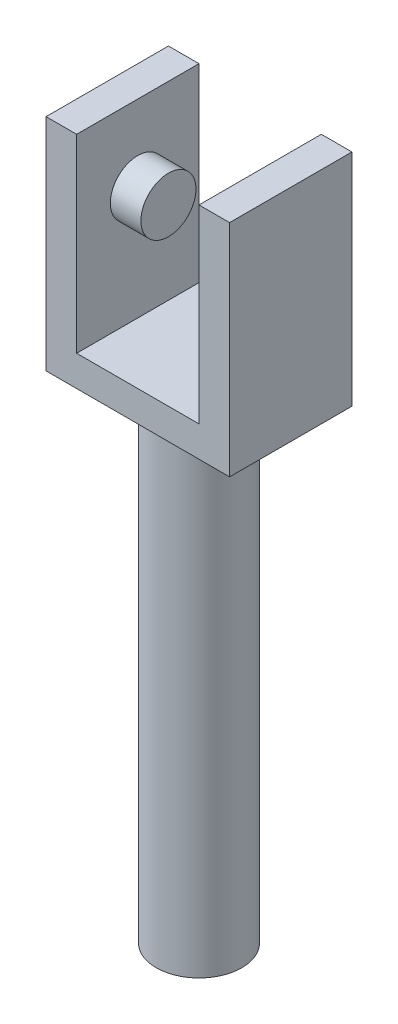
from build123d import *

# Parameters (mm, degrees)
SKETCH1_R           = 35
BOSS_EXTRUDE1_DEPTH = 392.5
SKETCH2_W           = 150
SKETCH2_H           = 100
BOSS_EXTRUDE2_DEPTH = 180
SKETCH3_W           = 100
SKETCH3_H           = 125
CUT_EXTRUDE1_DEPTH  = 150
SKETCH4_R           = 22.5
BOSS_EXTRUDE3_DEPTH = 25
BOSS_EXTRUDE4_START = 25
SKETCH5_R           = 22.5
BOSS_EXTRUDE4_DEPTH = 25
SKETCH6_W           = 100
SKETCH6_H           = 30
CUT_EXTRUDE2_DEPTH  = 586.987414541


with BuildPart() as part:
    # Sketch1 → Boss-Extrude1 (new body)
    with BuildSketch(Plane(origin=(0, 0, 0), x_dir=(1, 0, 0), z_dir=(0, 1, 0))):
        with Locations(Location((0, 0, 0), (0, 0, 270))):
            Circle(SKETCH1_R)
    extrude(amount=BOSS_EXTRUDE1_DEPTH)

    # Sketch2 → Boss-Extrude2 (add)
    with BuildSketch(Plane(origin=(0, 392.5, 0), x_dir=(1, 0, 0), z_dir=(0, 1, 0))):
        Rectangle(SKETCH2_W, SKETCH2_H)
    extrude(amount=BOSS_EXTRUDE2_DEPTH)

    # Sketch3 → Cut-Extrude1 (cut)
    with BuildSketch(Plane.XY.offset(50)):
        with Locations((0, 510)):
            Rectangle(SKETCH3_W, SKETCH3_H)
    extrude(amount=-CUT_EXTRUDE1_DEPTH, mode=Mode.SUBTRACT)

    # Sketch4 → Boss-Extrude3 (add)
    with BuildSketch(Plane.ZY.offset(-50)):
        with Locations(Location((0, 510, 0), (0, 0, 90))):
            Circle(SKETCH4_R)
    extrude(amount=BOSS_EXTRUDE3_DEPTH)

    # Sketch5 → Boss-Extrude4 (add)
    with BuildSketch(Plane(origin=(-50, 0, 0), x_dir=(0, 0, -1), z_dir=(1, 0, 0)).offset(BOSS_EXTRUDE4_START)):
        with Locations(Location((0, 510, 0), (0, 0, 90))):
            Circle(SKETCH5_R)
    extrude(amount=-BOSS_EXTRUDE4_DEPTH)

    # Sketch6 → Cut-Extrude2 (cut, through all)
    with BuildSketch(Plane.XY.offset(50)):
        with Locations((0, 432.5)):
            Rectangle(SKETCH6_W, SKETCH6_H)
    extrude(amount=-CUT_EXTRUDE2_DEPTH, mode=Mode.SUBTRACT)


solid = part.part
